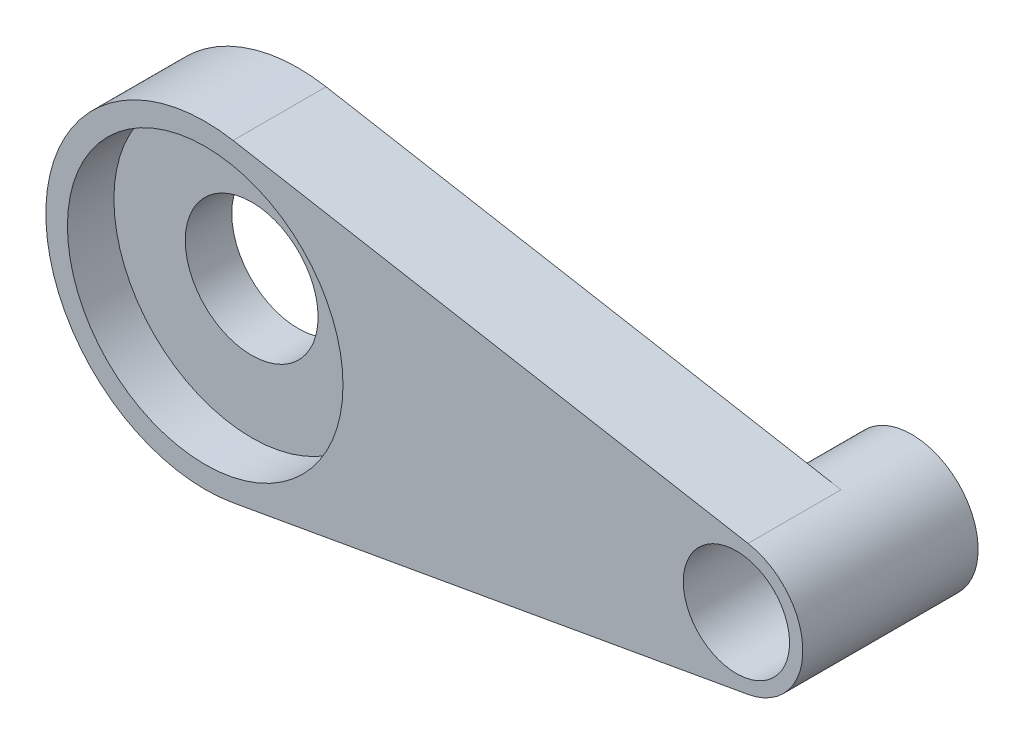
from build123d import *

# Parameters (mm, degrees)
EXTRUDE_1_DEPTH     = 7
SKETCH_2_R          = 10.375
CUT_EXTRUDE_1_DEPTH = 3.5
SKETCH_6_R          = 5
CUT_EXTRUDE_2_DEPTH = 48.095647357
EXTRUDE_START       = 6.2
SKETCH_8_R          = 5
EXTRUDE_2_DEPTH     = 6.2


with BuildPart() as part:
    # 草图1 → 凸台-拉伸1 (new body)
    with BuildSketch(Plane.XY):
        with BuildLine():
            Line((2.1, 11.814821201), (40.875, 4.922842167))
            ThreePointArc((40.875, 4.922842167), (45, 0), (40.875, -4.922842167))
            Line((40.875, -4.922842167), (2.1, -11.814821201))
            ThreePointArc((2.1, -11.814821201), (-12, 0), (2.1, 11.814821201))
        make_face()
    extrude(amount=EXTRUDE_1_DEPTH)

    # 草图2 → 切除-拉伸1 (cut)
    with BuildSketch(Plane.XY.offset(7)):
        Circle(SKETCH_2_R)
    extrude(amount=-CUT_EXTRUDE_1_DEPTH, mode=Mode.SUBTRACT)

    # 草图6 → 切除-拉伸2 (cut, through all)
    with BuildSketch(Plane(origin=(0, 0, 0), x_dir=(-1, 0, 0), z_dir=(0, 0, -1))):
        Circle(SKETCH_6_R)
    extrude(amount=-CUT_EXTRUDE_2_DEPTH, mode=Mode.SUBTRACT)

    # 草图8 → 凸台-拉伸2 (add)
    with BuildSketch(Plane(origin=(0, 0, 0), x_dir=(-1, 0, 0), z_dir=(0, 0, -1)).offset(EXTRUDE_START)):
        with Locations((-40, 0)):
            Circle(SKETCH_8_R)
    extrude(amount=-EXTRUDE_2_DEPTH)

    # 草图9 → 切除-旋转1 (revolve, cut)
    with BuildSketch(Plane(origin=(0, 0, 0), x_dir=(1, 0, 0), z_dir=(0, 1, 0))):
        Polygon((40, 6.2), (38, 6.2), (38, 2.7), (36, 2.7), (36, -7), (40, -7), align=None)
    revolve(axis=Axis((40, 0, -14.45), (0, 0, 1)), mode=Mode.SUBTRACT)


solid = part.part
